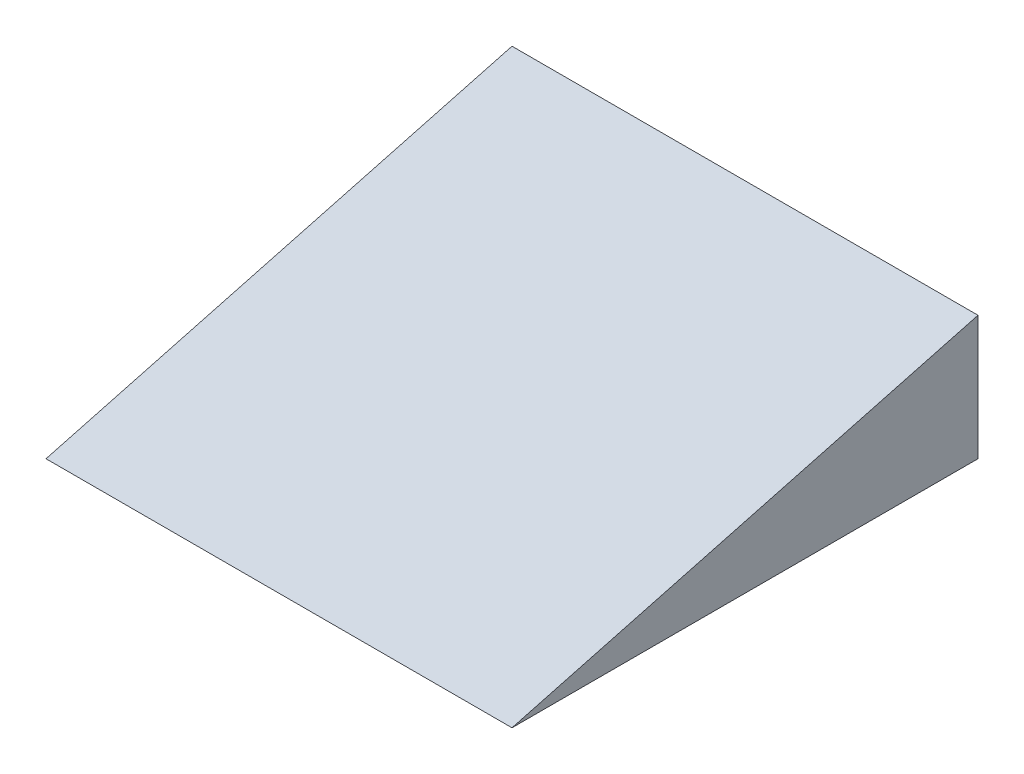
from build123d import *

# Parameters (mm, degrees)
EXTRUDE_1_DEPTH = 1500


with BuildPart() as part:
    # 草图1 → 凸台-拉伸1 (new body)
    with BuildSketch(Plane(origin=(0, 0, 0), x_dir=(0, 0, -1), z_dir=(1, 0, 0))):
        Polygon((0, 0), (1500, 0), (1500, 400), align=None)
    extrude(amount=EXTRUDE_1_DEPTH)


solid = part.part
